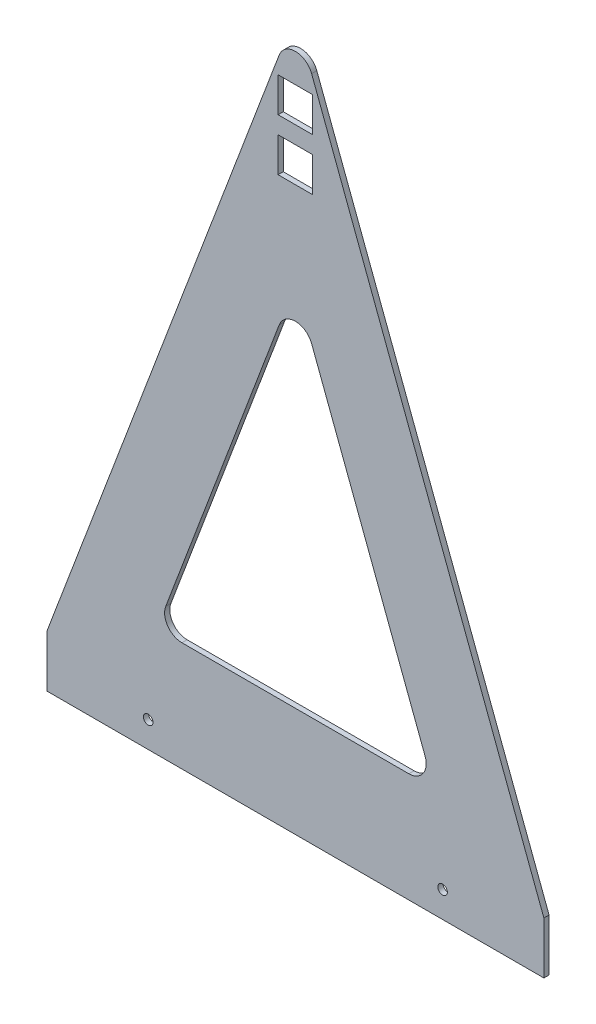
from build123d import *

# Parameters (mm, degrees)
CROQUIS1_W                   = 20
CROQUIS1_H                   = 20
SALIENTE_EXTRUIR1_DEPTH      = 3
TALADRO_DE_MARGEN_PARA_M52_D = 5.5
CORTAR_EXTRUIR1_DEPTH        = 3


with BuildPart() as part:
    # Croquis1 → Saliente-Extruir1 (new body)
    with BuildSketch(Plane.XY):
        with BuildLine():
            Line((-143.5, 0), (143.5, 0))
            Line((143.5, 0), (143.5, 30))
            Line((143.5, 30), (9.355173022, 385.226719524))
            ThreePointArc((9.355173022, 385.226719524), (0, 391.693910765), (-9.355173022, 385.226719524))
            Line((-9.355173022, 385.226719524), (-143.5, 30))
            Line((-143.5, 30), (-143.5, 0))
        make_face()
        with Locations((0, 365)):
            Rectangle(CROQUIS1_W, CROQUIS1_H, mode=Mode.SUBTRACT)
        with Locations((0, 335)):
            Rectangle(CROQUIS1_W, CROQUIS1_H, mode=Mode.SUBTRACT)
    extrude(amount=SALIENTE_EXTRUIR1_DEPTH)

    # Taladro de margen para M52 (through all)
    with Locations(Plane(origin=(0, 0, 0), x_dir=(-1, 0, 0), z_dir=(0, 0, -1))):
        with Locations((-85, 15), (85, 15)):
            Hole(TALADRO_DE_MARGEN_PARA_M52_D / 2)

    # Croquis4 → Cortar-Extruir1 (cut)
    with BuildSketch(Plane(origin=(0, 0, 0), x_dir=(-1, 0, 0), z_dir=(0, 0, -1))):
        with BuildLine():
            Line((9.355173022, 250.226719524), (74.889584061, 76.686118864))
            ThreePointArc((74.889584061, 76.686118864), (73.760226731, 67.466838773), (65.534411039, 63.153310105))
            Line((65.534411039, 63.153310105), (-65.534411039, 63.153310105))
            ThreePointArc((-65.534411039, 63.153310105), (-73.760226731, 67.466838773), (-74.889584061, 76.686118864))
            Line((-74.889584061, 76.686118864), (-9.355173022, 250.226719524))
            ThreePointArc((-9.355173022, 250.226719524), (0, 256.693910765), (9.355173022, 250.226719524))
        make_face()
    extrude(amount=-CORTAR_EXTRUIR1_DEPTH, mode=Mode.SUBTRACT)


solid = part.part
